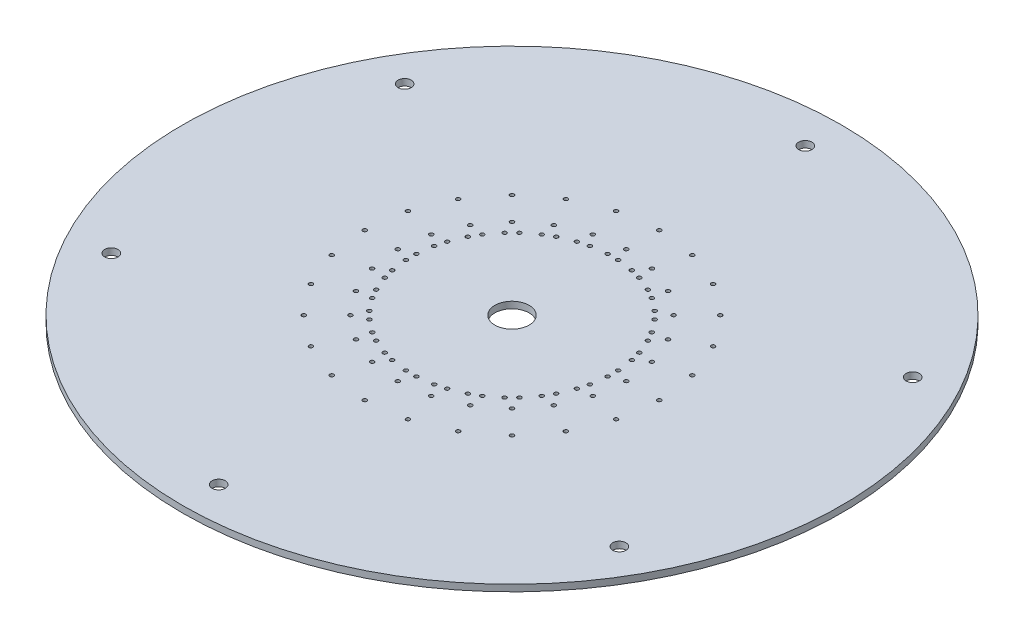
from build123d import *

# Parameters (mm, degrees)
SKETCH1_R           = 250
SKETCH1_R_2         = 1.5
SKETCH1_R_3         = 13
SKETCH1_R_4         = 5
BOSS_EXTRUDE1_DEPTH = 2.5


with BuildPart() as part:
    # Sketch1 → Boss-Extrude1 (new, symmetric)
    with BuildSketch(Plane(origin=(0, 0, 0), x_dir=(1, 0, 0), z_dir=(0, 1, 0))):
        with Locations(Location((0, 0, 0), (0, 0, 270))):
            Circle(SKETCH1_R)
        with Locations(Location((-4, 76.547549861, 0), (0, 0, 270))):
            Circle(SKETCH1_R_2, mode=Mode.SUBTRACT)
        with Locations(Location((4, 76.547549861, 0), (0, 0, 90))):
            Circle(SKETCH1_R_2, mode=Mode.SUBTRACT)
        with Locations(Location((15.948260455, 74.97453153, 0), (0, 0, 270))):
            Circle(SKETCH1_R_2, mode=Mode.SUBTRACT)
        with Locations(Location((23.675667065, 72.903979169, 0), (0, 0, 90))):
            Circle(SKETCH1_R_2, mode=Mode.SUBTRACT)
        with Locations(Location((34.809673315, 68.292122777, 0), (0, 0, 270))):
            Circle(SKETCH1_R_2, mode=Mode.SUBTRACT)
        with Locations(Location((41.737876545, 64.292122777, 0), (0, 0, 90))):
            Circle(SKETCH1_R_2, mode=Mode.SUBTRACT)
        with Locations(Location((51.298864465, 56.955718714, 0), (0, 0, 270))):
            Circle(SKETCH1_R_2, mode=Mode.SUBTRACT)
        with Locations(Location((56.955718714, 51.298864465, 0), (0, 0, 90))):
            Circle(SKETCH1_R_2, mode=Mode.SUBTRACT)
        with Locations(Location((64.292122777, 41.737876545, 0), (0, 0, 270))):
            Circle(SKETCH1_R_2, mode=Mode.SUBTRACT)
        with Locations(Location((68.292122777, 34.809673315, 0), (0, 0, 90))):
            Circle(SKETCH1_R_2, mode=Mode.SUBTRACT)
        with Locations(Location((72.903979169, 23.675667065, 0), (0, 0, 270))):
            Circle(SKETCH1_R_2, mode=Mode.SUBTRACT)
        with Locations(Location((74.97453153, 15.948260455, 0), (0, 0, 90))):
            Circle(SKETCH1_R_2, mode=Mode.SUBTRACT)
        with Locations(Location((76.547549861, 4, 0), (0, 0, 270))):
            Circle(SKETCH1_R_2, mode=Mode.SUBTRACT)
        with Locations(Location((76.547549861, -4, 0), (0, 0, 90))):
            Circle(SKETCH1_R_2, mode=Mode.SUBTRACT)
        with Locations(Location((74.97453153, -15.948260455, 0), (0, 0, 270))):
            Circle(SKETCH1_R_2, mode=Mode.SUBTRACT)
        with Locations(Location((72.903979169, -23.675667065, 0), (0, 0, 90))):
            Circle(SKETCH1_R_2, mode=Mode.SUBTRACT)
        with Locations(Location((68.292122777, -34.809673315, 0), (0, 0, 270))):
            Circle(SKETCH1_R_2, mode=Mode.SUBTRACT)
        with Locations(Location((64.292122777, -41.737876545, 0), (0, 0, 90))):
            Circle(SKETCH1_R_2, mode=Mode.SUBTRACT)
        with Locations(Location((56.955718714, -51.298864465, 0), (0, 0, 270))):
            Circle(SKETCH1_R_2, mode=Mode.SUBTRACT)
        with Locations(Location((51.298864465, -56.955718714, 0), (0, 0, 90))):
            Circle(SKETCH1_R_2, mode=Mode.SUBTRACT)
        with Locations(Location((41.737876545, -64.292122777, 0), (0, 0, 270))):
            Circle(SKETCH1_R_2, mode=Mode.SUBTRACT)
        with Locations(Location((34.809673315, -68.292122777, 0), (0, 0, 90))):
            Circle(SKETCH1_R_2, mode=Mode.SUBTRACT)
        with Locations(Location((23.675667065, -72.903979169, 0), (0, 0, 270))):
            Circle(SKETCH1_R_2, mode=Mode.SUBTRACT)
        with Locations(Location((15.948260455, -74.97453153, 0), (0, 0, 90))):
            Circle(SKETCH1_R_2, mode=Mode.SUBTRACT)
        with Locations(Location((4, -76.547549861, 0), (0, 0, 270))):
            Circle(SKETCH1_R_2, mode=Mode.SUBTRACT)
        with Locations(Location((-4, -76.547549861, 0), (0, 0, 90))):
            Circle(SKETCH1_R_2, mode=Mode.SUBTRACT)
        with Locations(Location((-15.948260455, -74.97453153, 0), (0, 0, 270))):
            Circle(SKETCH1_R_2, mode=Mode.SUBTRACT)
        with Locations(Location((-23.675667065, -72.903979169, 0), (0, 0, 90))):
            Circle(SKETCH1_R_2, mode=Mode.SUBTRACT)
        with Locations(Location((-34.809673315, -68.292122777, 0), (0, 0, 270))):
            Circle(SKETCH1_R_2, mode=Mode.SUBTRACT)
        with Locations(Location((-41.737876545, -64.292122777, 0), (0, 0, 90))):
            Circle(SKETCH1_R_2, mode=Mode.SUBTRACT)
        with Locations(Location((-51.298864465, -56.955718714, 0), (0, 0, 270))):
            Circle(SKETCH1_R_2, mode=Mode.SUBTRACT)
        with Locations(Location((-56.955718714, -51.298864465, 0), (0, 0, 90))):
            Circle(SKETCH1_R_2, mode=Mode.SUBTRACT)
        with Locations(Location((-64.292122777, -41.737876545, 0), (0, 0, 270))):
            Circle(SKETCH1_R_2, mode=Mode.SUBTRACT)
        with Locations(Location((-68.292122777, -34.809673315, 0), (0, 0, 90))):
            Circle(SKETCH1_R_2, mode=Mode.SUBTRACT)
        with Locations(Location((-72.903979169, -23.675667065, 0), (0, 0, 270))):
            Circle(SKETCH1_R_2, mode=Mode.SUBTRACT)
        with Locations(Location((-74.97453153, -15.948260455, 0), (0, 0, 90))):
            Circle(SKETCH1_R_2, mode=Mode.SUBTRACT)
        with Locations(Location((-76.54754986, -4, 0), (0, 0, 270))):
            Circle(SKETCH1_R_2, mode=Mode.SUBTRACT)
        with Locations(Location((-76.54754986, 4, 0), (0, 0, 90))):
            Circle(SKETCH1_R_2, mode=Mode.SUBTRACT)
        with Locations(Location((-74.97453153, 15.948260455, 0), (0, 0, 270))):
            Circle(SKETCH1_R_2, mode=Mode.SUBTRACT)
        with Locations(Location((-72.903979169, 23.675667065, 0), (0, 0, 90))):
            Circle(SKETCH1_R_2, mode=Mode.SUBTRACT)
        with Locations(Location((-68.292122777, 34.809673315, 0), (0, 0, 270))):
            Circle(SKETCH1_R_2, mode=Mode.SUBTRACT)
        with Locations(Location((-64.292122777, 41.737876545, 0), (0, 0, 90))):
            Circle(SKETCH1_R_2, mode=Mode.SUBTRACT)
        with Locations(Location((-56.955718714, 51.298864465, 0), (0, 0, 270))):
            Circle(SKETCH1_R_2, mode=Mode.SUBTRACT)
        with Locations(Location((-51.298864465, 56.955718714, 0), (0, 0, 90))):
            Circle(SKETCH1_R_2, mode=Mode.SUBTRACT)
        with Locations(Location((-41.737876545, 64.292122777, 0), (0, 0, 270))):
            Circle(SKETCH1_R_2, mode=Mode.SUBTRACT)
        with Locations(Location((-34.809673315, 68.292122777, 0), (0, 0, 90))):
            Circle(SKETCH1_R_2, mode=Mode.SUBTRACT)
        with Locations(Location((-23.675667065, 72.903979169, 0), (0, 0, 270))):
            Circle(SKETCH1_R_2, mode=Mode.SUBTRACT)
        with Locations(Location((-15.948260455, 74.97453153, 0), (0, 0, 90))):
            Circle(SKETCH1_R_2, mode=Mode.SUBTRACT)
        with Locations(Location((0, 0, 0), (0, 0, 270))):
            Circle(SKETCH1_R_3, mode=Mode.SUBTRACT)
        with Locations(Location((86.65, 0, 0), (0, 0, 270))):
            Circle(SKETCH1_R_2, mode=Mode.SUBTRACT)
        with Locations(Location((111.65, 0, 0), (0, 0, 270))):
            Circle(SKETCH1_R_2, mode=Mode.SUBTRACT)
        with Locations(Location((107.845618505, -28.897146386, 0), (0, 0, 270))):
            Circle(SKETCH1_R_2, mode=Mode.SUBTRACT)
        with Locations(Location((96.691736333, -55.825, 0), (0, 0, 270))):
            Circle(SKETCH1_R_2, mode=Mode.SUBTRACT)
        with Locations(Location((78.948472119, -78.948472119, 0), (0, 0, 270))):
            Circle(SKETCH1_R_2, mode=Mode.SUBTRACT)
        with Locations(Location((55.825, -96.691736333, 0), (0, 0, 270))):
            Circle(SKETCH1_R_2, mode=Mode.SUBTRACT)
        with Locations(Location((28.897146386, -107.845618505, 0), (0, 0, 270))):
            Circle(SKETCH1_R_2, mode=Mode.SUBTRACT)
        with Locations(Location((0, -111.65, 0), (0, 0, 270))):
            Circle(SKETCH1_R_2, mode=Mode.SUBTRACT)
        with Locations(Location((-28.897146386, -107.845618505, 0), (0, 0, 270))):
            Circle(SKETCH1_R_2, mode=Mode.SUBTRACT)
        with Locations(Location((-55.825, -96.691736333, 0), (0, 0, 270))):
            Circle(SKETCH1_R_2, mode=Mode.SUBTRACT)
        with Locations(Location((-78.948472119, -78.948472119, 0), (0, 0, 270))):
            Circle(SKETCH1_R_2, mode=Mode.SUBTRACT)
        with Locations(Location((-96.691736333, -55.825, 0), (0, 0, 270))):
            Circle(SKETCH1_R_2, mode=Mode.SUBTRACT)
        with Locations(Location((-107.845618505, -28.897146386, 0), (0, 0, 270))):
            Circle(SKETCH1_R_2, mode=Mode.SUBTRACT)
        with Locations(Location((-111.65, 0, 0), (0, 0, 270))):
            Circle(SKETCH1_R_2, mode=Mode.SUBTRACT)
        with Locations(Location((-107.845618505, 28.897146386, 0), (0, 0, 270))):
            Circle(SKETCH1_R_2, mode=Mode.SUBTRACT)
        with Locations(Location((-96.691736333, 55.825, 0), (0, 0, 270))):
            Circle(SKETCH1_R_2, mode=Mode.SUBTRACT)
        with Locations(Location((-78.948472119, 78.948472119, 0), (0, 0, 270))):
            Circle(SKETCH1_R_2, mode=Mode.SUBTRACT)
        with Locations(Location((-55.825, 96.691736333, 0), (0, 0, 270))):
            Circle(SKETCH1_R_2, mode=Mode.SUBTRACT)
        with Locations(Location((-28.897146386, 107.845618505, 0), (0, 0, 270))):
            Circle(SKETCH1_R_2, mode=Mode.SUBTRACT)
        with Locations(Location((0, 111.65, 0), (0, 0, 270))):
            Circle(SKETCH1_R_2, mode=Mode.SUBTRACT)
        with Locations(Location((28.897146386, 107.845618505, 0), (0, 0, 270))):
            Circle(SKETCH1_R_2, mode=Mode.SUBTRACT)
        with Locations(Location((55.825, 96.691736333, 0), (0, 0, 270))):
            Circle(SKETCH1_R_2, mode=Mode.SUBTRACT)
        with Locations(Location((78.948472119, 78.948472119, 0), (0, 0, 270))):
            Circle(SKETCH1_R_2, mode=Mode.SUBTRACT)
        with Locations(Location((96.691736333, 55.825, 0), (0, 0, 270))):
            Circle(SKETCH1_R_2, mode=Mode.SUBTRACT)
        with Locations(Location((107.845618505, 28.897146386, 0), (0, 0, 270))):
            Circle(SKETCH1_R_2, mode=Mode.SUBTRACT)
        with Locations(Location((83.697472848, -22.426670258, 0), (0, 0, 270))):
            Circle(SKETCH1_R_2, mode=Mode.SUBTRACT)
        with Locations(Location((75.041101238, -43.325, 0), (0, 0, 270))):
            Circle(SKETCH1_R_2, mode=Mode.SUBTRACT)
        with Locations(Location((61.27080259, -61.27080259, 0), (0, 0, 270))):
            Circle(SKETCH1_R_2, mode=Mode.SUBTRACT)
        with Locations(Location((43.325, -75.041101238, 0), (0, 0, 270))):
            Circle(SKETCH1_R_2, mode=Mode.SUBTRACT)
        with Locations(Location((22.426670258, -83.697472848, 0), (0, 0, 270))):
            Circle(SKETCH1_R_2, mode=Mode.SUBTRACT)
        with Locations(Location((0, -86.65, 0), (0, 0, 270))):
            Circle(SKETCH1_R_2, mode=Mode.SUBTRACT)
        with Locations(Location((-22.426670258, -83.697472848, 0), (0, 0, 270))):
            Circle(SKETCH1_R_2, mode=Mode.SUBTRACT)
        with Locations(Location((-43.325, -75.041101238, 0), (0, 0, 270))):
            Circle(SKETCH1_R_2, mode=Mode.SUBTRACT)
        with Locations(Location((-61.27080259, -61.27080259, 0), (0, 0, 270))):
            Circle(SKETCH1_R_2, mode=Mode.SUBTRACT)
        with Locations(Location((-75.041101238, -43.325, 0), (0, 0, 270))):
            Circle(SKETCH1_R_2, mode=Mode.SUBTRACT)
        with Locations(Location((-83.697472848, -22.426670258, 0), (0, 0, 270))):
            Circle(SKETCH1_R_2, mode=Mode.SUBTRACT)
        with Locations(Location((-86.65, 0, 0), (0, 0, 270))):
            Circle(SKETCH1_R_2, mode=Mode.SUBTRACT)
        with Locations(Location((-83.697472848, 22.426670258, 0), (0, 0, 270))):
            Circle(SKETCH1_R_2, mode=Mode.SUBTRACT)
        with Locations(Location((-75.041101238, 43.325, 0), (0, 0, 270))):
            Circle(SKETCH1_R_2, mode=Mode.SUBTRACT)
        with Locations(Location((-61.27080259, 61.27080259, 0), (0, 0, 270))):
            Circle(SKETCH1_R_2, mode=Mode.SUBTRACT)
        with Locations(Location((-43.325, 75.041101238, 0), (0, 0, 270))):
            Circle(SKETCH1_R_2, mode=Mode.SUBTRACT)
        with Locations(Location((-22.426670258, 83.697472848, 0), (0, 0, 270))):
            Circle(SKETCH1_R_2, mode=Mode.SUBTRACT)
        with Locations(Location((0, 86.65, 0), (0, 0, 270))):
            Circle(SKETCH1_R_2, mode=Mode.SUBTRACT)
        with Locations(Location((22.426670258, 83.697472848, 0), (0, 0, 270))):
            Circle(SKETCH1_R_2, mode=Mode.SUBTRACT)
        with Locations(Location((43.325, 75.041101238, 0), (0, 0, 270))):
            Circle(SKETCH1_R_2, mode=Mode.SUBTRACT)
        with Locations(Location((61.27080259, 61.27080259, 0), (0, 0, 270))):
            Circle(SKETCH1_R_2, mode=Mode.SUBTRACT)
        with Locations(Location((75.041101238, 43.325, 0), (0, 0, 270))):
            Circle(SKETCH1_R_2, mode=Mode.SUBTRACT)
        with Locations(Location((83.697472848, 22.426670258, 0), (0, 0, 270))):
            Circle(SKETCH1_R_2, mode=Mode.SUBTRACT)
        with Locations(Location((0, 222.5, 0), (0, 0, 270))):
            Circle(SKETCH1_R_4, mode=Mode.SUBTRACT)
        with Locations(Location((192.690652342, 111.25, 0), (0, 0, 270))):
            Circle(SKETCH1_R_4, mode=Mode.SUBTRACT)
        with Locations(Location((192.690652342, -111.25, 0), (0, 0, 270))):
            Circle(SKETCH1_R_4, mode=Mode.SUBTRACT)
        with Locations(Location((0, -222.5, 0), (0, 0, 270))):
            Circle(SKETCH1_R_4, mode=Mode.SUBTRACT)
        with Locations(Location((-192.690652342, -111.25, 0), (0, 0, 270))):
            Circle(SKETCH1_R_4, mode=Mode.SUBTRACT)
        with Locations(Location((-192.690652342, 111.25, 0), (0, 0, 270))):
            Circle(SKETCH1_R_4, mode=Mode.SUBTRACT)
    extrude(amount=BOSS_EXTRUDE1_DEPTH, both=True)


solid = part.part
